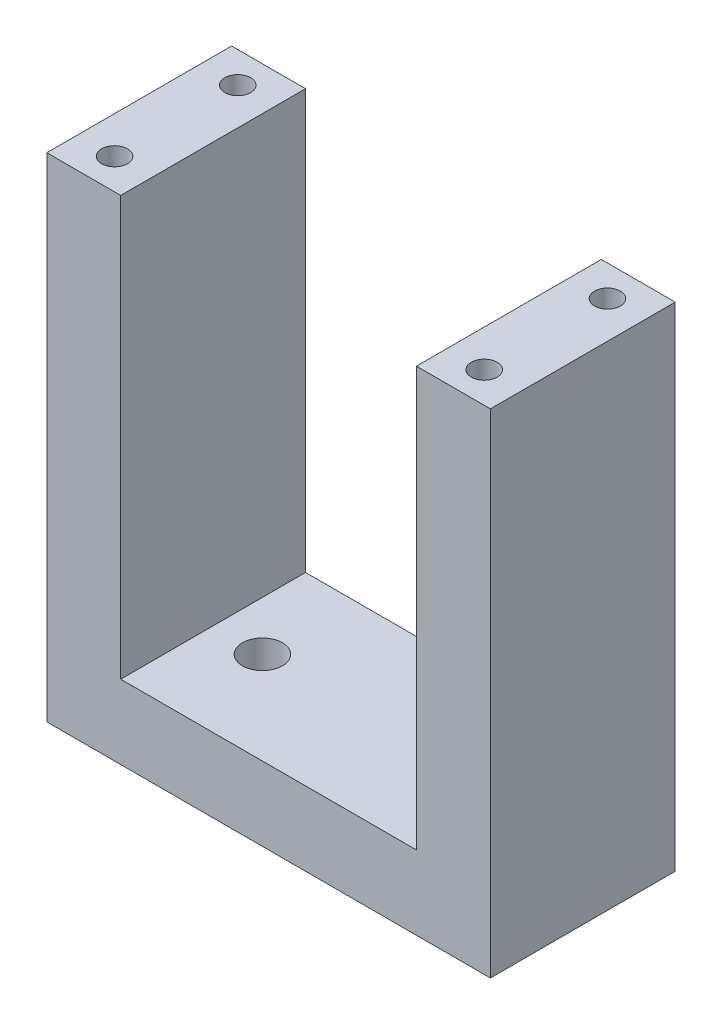
from build123d import *

# Parameters (mm, degrees)
EXTRUDE_1_DEPTH     = 15
M5X0_8_1_D          = 4.2
M5X0_8_1_DEPTH      = 12.4
M5X0_8_1_TIP        = 1.2618073
SKETCH_4_R          = 3.25
CUT_EXTRUDE_1_DEPTH = 79.390050389


with BuildPart() as part:
    # 草图1 → 凸台-拉伸1 (new, symmetric)
    with BuildSketch(Plane.XY):
        Polygon((-36, 80), (-36, 0), (36, 0), (36, 80), (24, 80), (24, 12), (-24, 12), (-24, 80), align=None)
    extrude(amount=EXTRUDE_1_DEPTH, both=True)

    # M5x0.8 螺纹孔1
    with Locations(Plane(origin=(0, 80, 0), x_dir=(-1, 0, 0), z_dir=(0, 1, 0))):
        with Locations((-30, -10), (30, -10), (30, 10), (-30, 10)):
            Hole(M5X0_8_1_D / 2, depth=M5X0_8_1_DEPTH)
            with Locations((0, 0, -(M5X0_8_1_DEPTH + M5X0_8_1_TIP / 2))):  # 118° drill point
                Cone(0, M5X0_8_1_D / 2, M5X0_8_1_TIP, mode=Mode.SUBTRACT)

    # 草图4 → 切除-拉伸1 (cut, through all)
    with BuildSketch(Plane(origin=(0, 12, 0), x_dir=(1, 0, 0), z_dir=(0, 1, 0))):
        with Locations(Location((-16, 0, 0), (0, 0, 270))):
            Circle(SKETCH_4_R)
        with Locations(Location((16, 0, 0), (0, 0, 270))):
            Circle(SKETCH_4_R)
    extrude(amount=-CUT_EXTRUDE_1_DEPTH, mode=Mode.SUBTRACT)


solid = part.part
